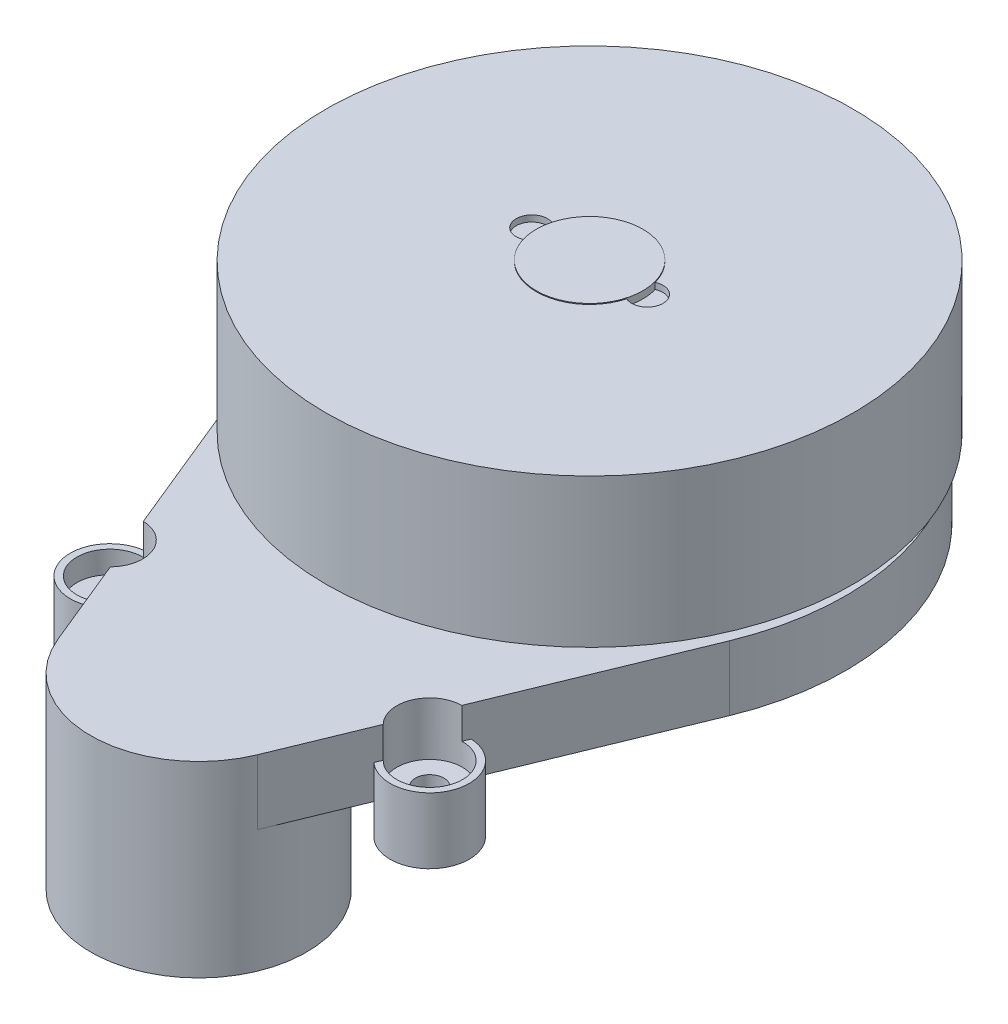
from build123d import *
from build123d.topology import SkipClean

# Parameters (mm, degrees)
EXTRUDE_1_DEPTH          = 7.3
EXTRUDE_START            = 13.8
SKETCH_3_R               = 12.150000000000004
EXTRUDE_2_DEPTH          = 13.8
SKETCH_4_R               = 2.6534701442365307
EXTRUDE_3_DEPTH          = 0.5
CUT_EXTRUDE_4_DEPTH      = 82.27733386375319
CUT_EXTRUDE_4_DEPTH_BACK = 82.27733386375319
EXTRUDE_START_2          = -3.5
EXTRUDE_4_DEPTH          = 7.4
EXTRUDE_START_3          = -6
EXTRUDE_5_DEPTH          = 3.2
EXTRUDE_6_DEPTH          = 0.7
EXTRUDE_7_DEPTH          = 3.8
CUT_EXTRUDE_5_DEPTH      = 85.0006101168319
CUT_EXTRUDE_5_DEPTH_BACK = 85.0006101168319
SKETCH_9_W               = 1.7500148859388673
SKETCH_9_H               = 0.32138781379330306
CUT_EXTRUDE_6_DEPTH      = 2
CUT_EXTRUDE_7_DEPTH      = 2
SKETCH_10_3_W            = 0.8750074429694372
SKETCH_10_3_H            = 0.32138781379330306
CUT_EXTRUDE_8_DEPTH      = 0.3
EXTRUDE_START_4          = -7.3
EXTRUDE_8_DEPTH          = 3.8
EXTRUDE_START_5          = -10.9
SKETCH_11_3_R            = 4.449999999999995
SKETCH_11_3_R_2          = 3.6999999999999944
EXTRUDE_9_DEPTH          = 7.4
EXTRUDE_START_6          = -9.2
SKETCH_11_4_R            = 3.6999999999999944
SKETCH_11_4_R_2          = 1.6000000000000087
EXTRUDE_10_DEPTH         = 3.2
SKETCH_12_R              = 25
EXTRUDE_11_DEPTH         = 1.5
SKETCH_13_R              = 29.65
SKETCH_13_R_2            = 25
EXTRUDE_12_DEPTH         = 16.7
CUT_EXTRUDE_9_DEPTH      = 0.7
EXTRUDE_START_7          = 0.1
EXTRUDE_13_DEPTH         = 0.1


with BuildPart() as part:
    # 草图2 → 凸台-拉伸1 (new body)
    with BuildSketch(Plane(origin=(0, 0, 0), x_dir=(1, 0, 0), z_dir=(0, 1, 0))):
        with BuildLine():
            Line((26.69124366947802, 33.05011363636363), (11.240853053177052, -4.611477272727274))
            ThreePointArc((11.240853053177052, -4.611477272727274), (-1.95e-15, -12.15), (-11.240853053177052, -4.6114772727272735))
            Line((-11.240853053177052, -4.6114772727272735), (-26.691243669478016, 33.05011363636363))
            ThreePointArc((-26.691243669478016, 33.05011363636363), (1.77e-15, 72.85), (26.69124366947802, 33.05011363636363))
        make_face()
    extrude(amount=EXTRUDE_1_DEPTH)

    # 草图3 → 凸台-拉伸2 (add)
    with BuildSketch(Plane.XZ.offset(EXTRUDE_START)):
        with Locations(Location((0, 0, 0), (0, 0, 270))):
            Circle(SKETCH_3_R)
    extrude(amount=-EXTRUDE_2_DEPTH)

    # 草图4 → 凸台-拉伸3 (add)
    with BuildSketch(Plane.XZ.offset(13.8)):
        with Locations(Location((0, 0, 0), (0, 0, 270))):
            Circle(SKETCH_4_R)
    extrude(amount=EXTRUDE_3_DEPTH)

    # 草图5 → 切除-拉伸4 (cut, two sides: drawn at the far end of the back side and taken through both)
    with BuildSketch(Plane(origin=(0, 7.3, 0), x_dir=(1, 0, 0), z_dir=(0, 1, 0)).offset(-CUT_EXTRUDE_4_DEPTH_BACK)):
        with BuildLine():
            Line((-16.400376678382514, 7.965283592675334), (-16.885624362824803, 9.148114514876607))
            ThreePointArc((-16.885624362824796, 9.148114514876617), (-19.48027694527436, 7.39272727272731), (-16.400376678382536, 7.965283592675336))
        make_face()
        with BuildLine():
            ThreePointArc((-16.399999999999995, 8), (-16.526398795555536, 8.623297272783896), (-16.885624362824796, 9.148114514876617))
            Line((-16.885624362824803, 9.148114514876607), (-16.400376678382514, 7.965283592675334))
            ThreePointArc((-16.400376678382536, 7.965283592675336), (-16.400094172367016, 7.982640774613078), (-16.399999999999995, 8))
        make_face()
        with BuildLine():
            Line((-16.885624362824803, 9.148114514876607), (-17.932262216036403, 11.69937989298532))
            ThreePointArc((-17.932262216036474, 11.69937989298527), (-21.423140435946916, 6.595681818181813), (-15.353738825171025, 5.4140182145667))
            Line((-15.353738825170945, 5.414018214566699), (-16.400376678382514, 7.965283592675334))
            ThreePointArc((-16.400376678382536, 7.965283592675336), (-19.48027694527436, 7.39272727272731), (-16.885624362824796, 9.148114514876617))
        make_face()
        with BuildLine():
            ThreePointArc((-14.299999999999995, 8), (-15.359864605681645, 10.59223554093132), (-17.932262216036474, 11.69937989298527))
            Line((-17.932262216036403, 11.69937989298532), (-16.885624362824803, 9.148114514876607))
            ThreePointArc((-16.885624362824796, 9.148114514876617), (-16.526398795555536, 8.623297272783896), (-16.399999999999995, 8))
            ThreePointArc((-16.399999999999995, 8), (-16.400094172367016, 7.982640774613078), (-16.400376678382536, 7.965283592675336))
            Line((-16.400376678382514, 7.965283592675334), (-15.353738825170945, 5.414018214566699))
            ThreePointArc((-15.353738825171025, 5.4140182145667), (-14.573546560445681, 6.6037848208222325), (-14.299999999999995, 7.999999999999999))
        make_face()
        with BuildLine():
            Line((16.40037667838252, 7.965283592675348), (16.885624362824785, 9.148114514876559))
            ThreePointArc((16.885624362824753, 9.148114514876577), (16.519723054725624, 8.607272727272665), (16.400376678382536, 7.965283592675339))
        make_face()
        with BuildLine():
            ThreePointArc((19.599999999999998, 8), (18.623297272783866, 9.473601204444472), (16.885624362824753, 9.148114514876577))
            Line((16.885624362824785, 9.148114514876559), (16.40037667838252, 7.965283592675348))
            ThreePointArc((16.400376678382536, 7.965283592675339), (18.017359225386915, 6.4000941723670195), (19.599999999999998, 8))
        make_face()
        with BuildLine():
            Line((16.885624362824785, 9.148114514876559), (17.932262216036392, 11.699379892985295))
            ThreePointArc((17.93226221603642, 11.69937989298527), (14.576859564053107, 9.40431818181826), (15.353738825170879, 5.414018214566849))
            Line((15.353738825171005, 5.414018214566843), (16.40037667838252, 7.965283592675348))
            ThreePointArc((16.400376678382536, 7.965283592675339), (16.519723054725624, 8.607272727272665), (16.885624362824753, 9.148114514876577))
        make_face()
        with BuildLine():
            ThreePointArc((21.699999999999996, 8), (20.592235540931295, 10.64013539431837), (17.93226221603642, 11.69937989298527))
            Line((17.932262216036392, 11.699379892985295), (16.885624362824785, 9.148114514876559))
            ThreePointArc((16.885624362824753, 9.148114514876577), (18.623297272783866, 9.473601204444472), (19.599999999999998, 8))
            ThreePointArc((19.599999999999998, 8), (18.017359225386915, 6.4000941723670195), (16.400376678382536, 7.965283592675339))
            Line((16.40037667838252, 7.965283592675348), (15.353738825171005, 5.414018214566843))
            ThreePointArc((15.353738825170879, 5.414018214566849), (19.39621517917767, 4.573546560445646), (21.699999999999996, 7.999999999999999))
        make_face()
    extrude(amount=CUT_EXTRUDE_4_DEPTH + CUT_EXTRUDE_4_DEPTH_BACK, mode=Mode.SUBTRACT)

    # 草图5<6> → 凸台-拉伸4 (add)
    with BuildSketch(Plane(origin=(0, 7.3, 0), x_dir=(1, 0, 0), z_dir=(0, 1, 0)).offset(EXTRUDE_START_2)):
        with BuildLine():
            ThreePointArc((-13.549999999999997, 8), (-14.938529448781747, 11.229535270595974), (-18.237594635516142, 12.443652640472019))
            Line((-18.237594635516302, 12.443652640471882), (-17.932262216036403, 11.69937989298532))
            ThreePointArc((-17.932262216036474, 11.69937989298527), (-15.359864605681645, 10.59223554093132), (-14.299999999999995, 8))
            ThreePointArc((-14.299999999999995, 7.999999999999999), (-14.573546560445681, 6.6037848208222325), (-15.353738825171025, 5.4140182145667))
            Line((-15.353738825170945, 5.414018214566699), (-15.048406405691011, 4.669745467080052))
            ThreePointArc((-15.04840640569094, 4.6697454670800695), (-13.94185439549815, 6.174088103806117), (-13.549999999999997, 7.999999999999999))
        make_face()
        with BuildLine():
            Line((-17.932262216036403, 11.69937989298532), (-18.237594635516302, 12.443652640471882))
            ThreePointArc((-18.237594635516142, 12.443652640472019), (-22.11702025404429, 6.311022727272792), (-15.048406405690944, 4.669745467080068))
            Line((-15.048406405691011, 4.669745467080052), (-15.353738825170945, 5.414018214566699))
            ThreePointArc((-15.353738825171025, 5.4140182145667), (-21.423140435946916, 6.595681818181813), (-17.932262216036474, 11.69937989298527))
        make_face()
    extrude_4 = extrude(amount=-EXTRUDE_4_DEPTH)

    # 草图5<7> → 凸台-拉伸5 (add)
    with BuildSketch(Plane(origin=(0, 7.3, 0), x_dir=(1, 0, 0), z_dir=(0, 1, 0)).offset(EXTRUDE_START_3)):
        with BuildLine():
            Line((-16.885624362824803, 9.148114514876607), (-17.932262216036403, 11.69937989298532))
            ThreePointArc((-17.932262216036474, 11.69937989298527), (-21.423140435946916, 6.595681818181813), (-15.353738825171025, 5.4140182145667))
            Line((-15.353738825170945, 5.414018214566699), (-16.400376678382514, 7.965283592675334))
            ThreePointArc((-16.400376678382536, 7.965283592675336), (-19.48027694527436, 7.39272727272731), (-16.885624362824796, 9.148114514876617))
        make_face()
        with BuildLine():
            ThreePointArc((-14.299999999999995, 8), (-15.359864605681645, 10.59223554093132), (-17.932262216036474, 11.69937989298527))
            Line((-17.932262216036403, 11.69937989298532), (-16.885624362824803, 9.148114514876607))
            ThreePointArc((-16.885624362824796, 9.148114514876617), (-16.526398795555536, 8.623297272783896), (-16.399999999999995, 8))
            ThreePointArc((-16.399999999999995, 8), (-16.400094172367016, 7.982640774613078), (-16.400376678382536, 7.965283592675336))
            Line((-16.400376678382514, 7.965283592675334), (-15.353738825170945, 5.414018214566699))
            ThreePointArc((-15.353738825171025, 5.4140182145667), (-14.573546560445681, 6.6037848208222325), (-14.299999999999995, 7.999999999999999))
        make_face()
    extrude_5 = extrude(amount=-EXTRUDE_5_DEPTH)

    # 镜向1: 凸台-拉伸4, 凸台-拉伸5 across plane
    add(extrude_4.mirror(Plane(origin=(0, 0, 0), x_dir=(0, 0, 1), z_dir=(1, 0, 0))))
    add(extrude_5.mirror(Plane(origin=(0, 0, 0), x_dir=(0, 0, 1), z_dir=(1, 0, 0))))

    # 草图6 → 凸台-拉伸6 (add)
    with BuildSketch(Plane.XZ):
        with BuildLine():
            Line((15.8, -20.499999999999996), (-15.8, -20.499999999999996))
            Line((-15.8, -20.499999999999996), (-20.43502728201668, -23.59904101897809))
            Line((-20.43502728201668, -23.59904101897809), (-24.122693566408294, -33.46603999613399))
            Line((-24.122693566408294, -33.46603999613399), (-24.122693566408294, -55.78940145331961))
            ThreePointArc((-24.122693566408294, -55.78940145331961), (-16.009915212385508, -65.55404710068618), (-4.3179082350567475, -70.5))
            Line((-4.3179082350567475, -70.5), (4.3179082350567475, -70.5))
            ThreePointArc((4.3179082350567475, -70.5), (16.00991521238551, -65.55404710068616), (24.122693566408294, -55.78940145331961))
            Line((24.122693566408294, -55.78940145331961), (24.122693566408294, -33.46603999613399))
            Line((24.122693566408294, -33.46603999613399), (20.43502728201668, -23.59904101897809))
            Line((20.43502728201668, -23.59904101897809), (15.8, -20.499999999999996))
        make_face()
    extrude(amount=EXTRUDE_6_DEPTH)

    # 草图7 → 凸台-拉伸7 (add)
    with BuildSketch(Plane.XZ.offset(0.7)):
        Polygon((-10.45, -23.199999999999992), (-6.199999999999999, -23.199999999999992), (-6.199999999999998, -31.499999999999993), (-10.449999999999998, -31.499999999999986), align=None)
    extrude(amount=EXTRUDE_7_DEPTH)

    # 草图8 → 切除-拉伸5 (cut, two sides: drawn at the far end of the back side and taken through both)
    with BuildSketch(Plane.ZY.offset(10.450000000000005).offset(-CUT_EXTRUDE_5_DEPTH_BACK)):
        Polygon((-30.449999999999985, -4.242314172372454), (-30.449999999999985, -3.042314172372454), (-28.22500744296942, -3.042314172372454), (-28.22500744296942, -3.363701986165757), (-26.47499255703055, -3.363701986165757), (-26.47499255703055, -3.042314172372454), (-24.249999999999986, -3.042314172372454), (-24.249999999999986, -4.242314172372454), align=None)
    extrude(amount=CUT_EXTRUDE_5_DEPTH + CUT_EXTRUDE_5_DEPTH_BACK, mode=Mode.SUBTRACT)

    # 草图9 → 切除-拉伸6 (cut)
    with BuildSketch(Plane(origin=(-6.200000000000002, 0, -6.5e-16), x_dir=(1e-16, 0, -1), z_dir=(1, 0, 1e-16))):
        with Locations((27.34999999999999, -3.2030080792691056)):
            Rectangle(SKETCH_9_W, SKETCH_9_H)
    extrude(amount=-CUT_EXTRUDE_6_DEPTH, mode=Mode.SUBTRACT)

    # 草图10 → 切除-拉伸7 (cut)
    with BuildSketch(Plane.ZY.offset(10.450000000000005)):
        Polygon((-30.68993252300798, -2.704247110124904), (-27.349999999999987, -2.704247110124904), (-27.349999999999987, -0.9500000000000002), (-30.945398751764372, -0.9500000000000002), (-30.945398751764372, -3.284247110124904), (-30.68993252300798, -3.284247110124904), align=None)
        Polygon((-27.349999999999987, -0.9500000000000002), (-27.349999999999987, -2.7042471101249044), (-24.010067476991992, -2.704247110124904), (-24.010067476991992, -3.284247110124904), (-23.7546012482356, -3.284247110124904), (-23.7546012482356, -0.9500000000000002), align=None)
    extrude(amount=-CUT_EXTRUDE_7_DEPTH, mode=Mode.SUBTRACT)

    # 草图10<3> → 切除-拉伸8 (cut)
    with BuildSketch(Plane.ZY.offset(10.450000000000005)):
        with Locations((-27.787503721484704, -3.2030080792691056)):
            Rectangle(SKETCH_10_3_W, SKETCH_10_3_H)
        with Locations((-26.91249627851527, -3.2030080792691056)):
            Rectangle(SKETCH_10_3_W, SKETCH_10_3_H)
    extrude(amount=-CUT_EXTRUDE_8_DEPTH, mode=Mode.SUBTRACT)

    # 草图11 → 凸台-拉伸8 (add)
    with BuildSketch(Plane(origin=(0, 7.3, 0), x_dir=(1, 0, 0), z_dir=(0, 1, 0)).offset(EXTRUDE_START_4)):
        with BuildLine():
            Line((5.298804384271591, 72.35921670457815), (4.4168303748038795, 79.54231857815292))
            ThreePointArc((4.416830374803872, 79.54231857815292), (4.441699852977298, 79.27166600093011), (4.44999999999999, 79))
            ThreePointArc((4.44999999999999, 79), (-0.27166600093012466, 74.55830014702269), (-4.416830374803881, 79.54231857815292))
            Line((-4.4168303748038795, 79.54231857815292), (-5.298804384271591, 72.35921670457815))
            ThreePointArc((-5.29880438427159, 72.35921670457816), (4.44e-15, 72.85000000000001), (5.298804384271589, 72.35921670457816))
        make_face()
    extrude(amount=EXTRUDE_8_DEPTH)

    # 草图11<3> → 凸台-拉伸9 (add)
    with BuildSketch(Plane(origin=(0, 7.3, 0), x_dir=(1, 0, 0), z_dir=(0, 1, 0)).offset(EXTRUDE_START_5)):
        with Locations(Location((-4.28e-15, 79, 0), (0, 0, 270))):
            Circle(SKETCH_11_3_R)
        with Locations(Location((-4.28e-15, 79, 0), (0, 0, 270))):
            Circle(SKETCH_11_3_R_2, mode=Mode.SUBTRACT)
    extrude(amount=EXTRUDE_9_DEPTH)

    # 草图11<4> → 凸台-拉伸10 (add)
    with BuildSketch(Plane(origin=(0, 7.3, 0), x_dir=(1, 0, 0), z_dir=(0, 1, 0)).offset(EXTRUDE_START_6)):
        with Locations(Location((-4.28e-15, 79, 0), (0, 0, 270))):
            Circle(SKETCH_11_4_R)
        with Locations(Location((-4.28e-15, 79, 0), (0, 0, 270))):
            Circle(SKETCH_11_4_R_2, mode=Mode.SUBTRACT)
    extrude(amount=EXTRUDE_10_DEPTH)

    # 草图12 → 凸台-拉伸11 (add)
    with BuildSketch(Plane(origin=(0, 7.3, 0), x_dir=(1, 0, 0), z_dir=(0, 1, 0))):
        with Locations(Location((0, 44, 0), (0, 0, 270))):
            Circle(SKETCH_12_R)
    extrude(amount=EXTRUDE_11_DEPTH)

    # 草图13 → 凸台-拉伸12 (add)
    # profile 1 of 2: a face of its own
    with BuildSketch(Plane(origin=(0, 8.8, 0), x_dir=(1, 0, 0), z_dir=(0, 1, 0))):
        with Locations(Location((0, 44, 0), (0, 0, 270))):
            Circle(SKETCH_13_R)
        with Locations(Location((0, 44, 0), (0, 0, 270))):
            Circle(SKETCH_13_R_2, mode=Mode.SUBTRACT)
    # profile 2 of 2: a face of its own
    with BuildSketch(Plane(origin=(0, 8.8, 0), x_dir=(1, 0, 0), z_dir=(0, 1, 0))):
        with Locations(Location((0, 44, 0), (0, 0, 270))):
            Circle(SKETCH_13_R_2)
    extrude(amount=EXTRUDE_12_DEPTH)

    # 草图14 → 切除-拉伸9 (cut)
    with BuildSketch(Plane(origin=(0, 25.500000000000004, 0), x_dir=(1, 0, 0), z_dir=(0, 1, 0))):
        with BuildLine():
            ThreePointArc((-5.780241666392653, 42.39102322014944), (-5.999999999999999, 44.00000000000001), (-5.78024166639265, 45.60897677985057))
            ThreePointArc((-5.780241666392652, 45.60897677985057), (-8.262628246935671, 44.00000000000001), (-5.780241666392653, 42.39102322014944))
        make_face()
        with BuildLine():
            ThreePointArc((5.7802416663926515, 45.608976779850565), (5.944806556918227, 44.81195751170984), (5.999999999999999, 44))
            ThreePointArc((5.999999999999999, 44), (5.944806556918228, 43.18804248829016), (5.780241666392651, 42.391023220149435))
            ThreePointArc((5.780241666392653, 42.391023220149435), (8.262628246935671, 44), (5.780241666392652, 45.608976779850565))
        make_face()
    extrude(amount=-CUT_EXTRUDE_9_DEPTH, mode=Mode.SUBTRACT)

    # 草图14<3> → 凸台-拉伸13 (add)
    with SkipClean():  # the faces are left unmerged after this step: merging them gives an invalid solid
        with BuildSketch(Plane(origin=(0, 25.500000000000004, 0), x_dir=(1, 0, 0), z_dir=(0, 1, 0)).offset(EXTRUDE_START_7)):
            with BuildLine():
                ThreePointArc((5.7802416663926515, 45.608976779850565), (3.6294723666737094, 48.77775369180454), (-8.49e-14, 50))
                Line((0, 50), (0, 38))
                ThreePointArc((-8.637e-14, 38), (3.6294723666737054, 39.22224630819545), (5.780241666392651, 42.391023220149435))
                ThreePointArc((5.780241666392651, 42.391023220149435), (5.944806556918228, 43.18804248829016), (5.999999999999999, 44))
                ThreePointArc((5.999999999999999, 44), (5.944806556918227, 44.81195751170984), (5.7802416663926515, 45.608976779850565))
            make_face()
            with BuildLine():
                Line((0, 38), (0, 50))
                ThreePointArc((-8.357e-14, 50), (-3.6294723666737743, 48.77775369180449), (-5.78024166639265, 45.60897677985057))
                ThreePointArc((-5.78024166639265, 45.60897677985057), (-5.999999999999999, 44.00000000000001), (-5.780241666392653, 42.39102322014944))
                ThreePointArc((-5.780241666392653, 42.39102322014944), (-3.6294723666737796, 39.22224630819551), (-8.637e-14, 38))
            make_face()
        extrude(amount=-EXTRUDE_13_DEPTH)


solid = part.part
